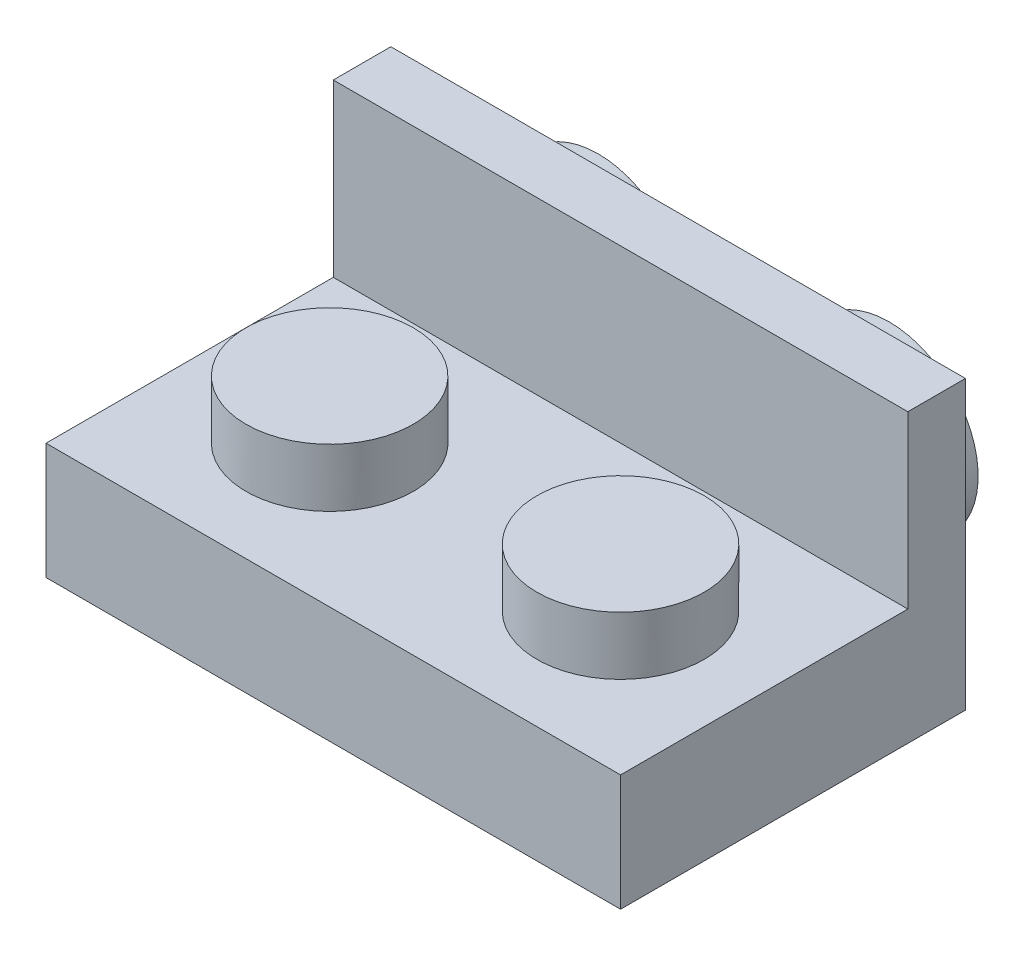
from build123d import *

# Parameters (mm, degrees)
MAINBASESKETCH_W             = 15.8
MAINBASESKETCH_H             = 3.2
MAINBASEEXTRUDE_DEPTH        = 7.9
STUDSSKETCH_R                = 2.3
STUDSEXTRUDE_DEPTH           = 1.6
STUDSPATTERN_COUNT           = 2
STUDSPATTERN_PITCH           = 8
STUDSPATTERN_COUNT_DIR2      = 2
STUDSPATTERN_PITCH_DIR2      = 8
MAINBASESHELL_T              = -1.2
LCUTBLUE_DEPTH               = 19.555463972
LCUTBLUE_DEPTH_BACK          = 19.555463972
CUTADDEDTOLCUT_DEPTH         = 2
MADESLIMCUTSKETCH_W          = 7.9
MADESLIMCUTSKETCH_H          = 7.9
MADESLIMCUT_DEPTH            = 19.897228453
MADESLIMFILLEXT_REACH        = 20.897
SKETCH33_W                   = 5.500952983
SKETCH33_H                   = 1.199047018
SLIMHOLEEXT_START            = -0.2
SLIMHOLESKETCH_R             = 1.75
SLIMHOLESKETCH_R_2           = 0.75
SLIMHOLEEXT_DEPTH            = 2
SHORTLEXTENSIONSKETCH_W      = 1.583745828
SHORTLEXTENSIONSKETCH_H      = 7.9
SHORTLEXTENDEDCUTSKETCH_W    = 13.4
SHORTLEXTENDEDCUTSKETCH_H    = 1.582792846
SHORTLEXTENDEDCUT_DEPTH      = 2
SHORTLUNDERSTUMPS_START      = -0.2
SHORTLUNDERSTUMPSKETCH_W     = 0.996828098
SHORTLUNDERSTUMPSKETCH_H     = 1.5
SHORTLUNDERSTUMPS_DEPTH      = 2.15
SHORTLUPPERCIRCLES_START     = -0.2
SHORTLUPPERCIRCLESSKETCH_R   = 2.45
SHORTLUPPERCIRCLESSKETCH_R_2 = 2
SHORTLUPPERCIRCLES_DEPTH     = 2


with BuildPart() as part:
    # MainBaseSketch → MainBaseExtrude (new, symmetric)
    with BuildSketch(Plane.XY):
        with Locations((8.581967213, 1.6)):
            Rectangle(MAINBASESKETCH_W, MAINBASESKETCH_H)
    extrude(amount=MAINBASEEXTRUDE_DEPTH, both=True)

    # StudsSketch → StudsExtrude (add)
    with BuildSketch(Plane(origin=(0, 3.2, 0), x_dir=(1, 0, 0), z_dir=(0, 1, 0))):
        with Locations(Location((4.581967213, 4, 0), (0, 0, 90))):
            Circle(STUDSSKETCH_R)
    studsextrude = extrude(amount=STUDSEXTRUDE_DEPTH)

    # StudsPattern: StudsExtrude 2 × 2
    with Locations(*[(j * STUDSPATTERN_PITCH_DIR2, 0, i * STUDSPATTERN_PITCH) for i in range(STUDSPATTERN_COUNT) for j in range(STUDSPATTERN_COUNT_DIR2) if (i, j) != (0, 0)]):
        add(studsextrude)

    # MainBaseShell
    mainbaseshell_openings = [part.faces().sort_by_distance(p)[0] for p in [
        (8.581967213, 0, 0),
    ]]
    offset(amount=MAINBASESHELL_T, openings=mainbaseshell_openings, kind=Kind.INTERSECTION)

    # LCUTBlueSketch → LCutBlue (cut, two sides: drawn at the far end of the back side and taken through both)
    with BuildSketch(Plane(origin=(0, 3.2, 0), x_dir=(1, 0, 0), z_dir=(0, 1, 0)).offset(-LCUTBLUE_DEPTH_BACK)):
        Polygon((8.581967213, 53.229874044), (8.581967213, 7.9), (8.581967213, 0), (16.481967213, 0), (61.811841258, 0), (125.917963912, 64.106122654), (72.688089868, 117.335996699), align=None)
    extrude(amount=LCUTBLUE_DEPTH + LCUTBLUE_DEPTH_BACK, mode=Mode.SUBTRACT)

    # CutAddedtoLSketch → CutAddedToLCut (add)
    with BuildSketch(Plane.XZ):
        Polygon((7.382920196, -6.7), (8.581967213, -6.7), (8.581967213, 0), (15.281967213, 0), (15.281967213, 1.199047018), (7.382920196, 1.199047018), (7.382920196, 0), align=None)
    extrude(amount=-CUTADDEDTOLCUT_DEPTH)

    # MadeSlimCutSketch → MadeSlimCut (cut, through all)
    with BuildSketch(Plane.XZ):
        with Locations((4.631967213, -3.95)):
            Rectangle(MADESLIMCUTSKETCH_W, MADESLIMCUTSKETCH_H)
    extrude(amount=-MADESLIMCUT_DEPTH, mode=Mode.SUBTRACT)

    # Sketch33 → MadeSlimFillExt (add, up to next)
    with BuildSketch(Plane.XZ, mode=Mode.PRIVATE) as madeslimfillext_sk1:
        with Locations((4.632443704, 0.599523509)):
            Rectangle(SKETCH33_W, SKETCH33_H)
    madeslimfillext_tool1 = extrude(madeslimfillext_sk1.sketch, amount=-MADESLIMFILLEXT_REACH, mode=Mode.PRIVATE) - part.part
    add(madeslimfillext_tool1.solids().sort_by_distance((4.632444, 0, 0.599524))[0])

    # SlimHoleSketch → SlimHoleExt (add)
    with BuildSketch(Plane.XZ.offset(-2).offset(SLIMHOLEEXT_START)):
        with Locations(Location((8.581967213, 4, 0), (0, 0, 270))):
            Circle(SLIMHOLESKETCH_R)
        with Locations(Location((8.581967213, 4, 0), (0, 0, 270))):
            Circle(SLIMHOLESKETCH_R_2, mode=Mode.SUBTRACT)
    extrude(amount=SLIMHOLEEXT_DEPTH)

    # ShortLExtension: sweep along a curve in space
    with BuildLine() as shortlextension_path:
        Line((0.681967213, 3.2, 0), (16.481967213, 3.2, 0))
    # ShortLExtensionSketch → ShortLExtension (sweep)
    with BuildSketch(Plane(origin=(16.481967213, 0, 0), x_dir=(0, 0, -1), z_dir=(1, 0, 0))):
        with Locations((0.791872914, 3.95)):
            Rectangle(SHORTLEXTENSIONSKETCH_W, SHORTLEXTENSIONSKETCH_H)
    sweep(path=shortlextension_path.line)

    # ShortLExtendedCutSketch → ShortLExtendedCut (cut)
    with BuildSketch(Plane.XZ):
        with Locations((8.581967213, 0.407650595)):
            Rectangle(SHORTLEXTENDEDCUTSKETCH_W, SHORTLEXTENDEDCUTSKETCH_H)
    extrude(amount=-SHORTLEXTENDEDCUT_DEPTH, mode=Mode.SUBTRACT)

    # ShortLUnderStumpSketch → ShortLUnderStumps (add)
    with BuildSketch(Plane.XZ.offset(-2).offset(SHORTLUNDERSTUMPS_START)):
        with Locations((4.581764801, 0.366254172)):
            Rectangle(SHORTLUNDERSTUMPSKETCH_W, SHORTLUNDERSTUMPSKETCH_H)
        with Locations((8.57767054, 0.366254172)):
            Rectangle(SHORTLUNDERSTUMPSKETCH_W, SHORTLUNDERSTUMPSKETCH_H)
        with Locations((12.582169625, 0.366254172)):
            Rectangle(SHORTLUNDERSTUMPSKETCH_W, SHORTLUNDERSTUMPSKETCH_H)
    extrude(amount=SHORTLUNDERSTUMPS_DEPTH)

    # ShortLUpperCirclesSketch → ShortLUpperCircles (add)
    # profile 1 of 2: a face of its own
    with BuildSketch(Plane(origin=(0, 0, -1.583745828), x_dir=(-1, 0, 0), z_dir=(0, 0, -1)).offset(SHORTLUPPERCIRCLES_START)):
        with Locations(Location((-12.581967213, 3.95, 0), (0, 0, 90))):
            Circle(SHORTLUPPERCIRCLESSKETCH_R)
        with Locations(Location((-12.581967213, 3.95, 0), (0, 0, 90))):
            Circle(SHORTLUPPERCIRCLESSKETCH_R_2, mode=Mode.SUBTRACT)
    # profile 2 of 2: a face of its own
    with BuildSketch(Plane(origin=(0, 0, -1.583745828), x_dir=(-1, 0, 0), z_dir=(0, 0, -1)).offset(SHORTLUPPERCIRCLES_START)):
        with Locations(Location((-4.581967213, 3.95, 0), (0, 0, 270))):
            Circle(SHORTLUPPERCIRCLESSKETCH_R)
        with Locations(Location((-4.581967213, 3.95, 0), (0, 0, 270))):
            Circle(SHORTLUPPERCIRCLESSKETCH_R_2, mode=Mode.SUBTRACT)
    extrude(amount=SHORTLUPPERCIRCLES_DEPTH)


solid = part.part
